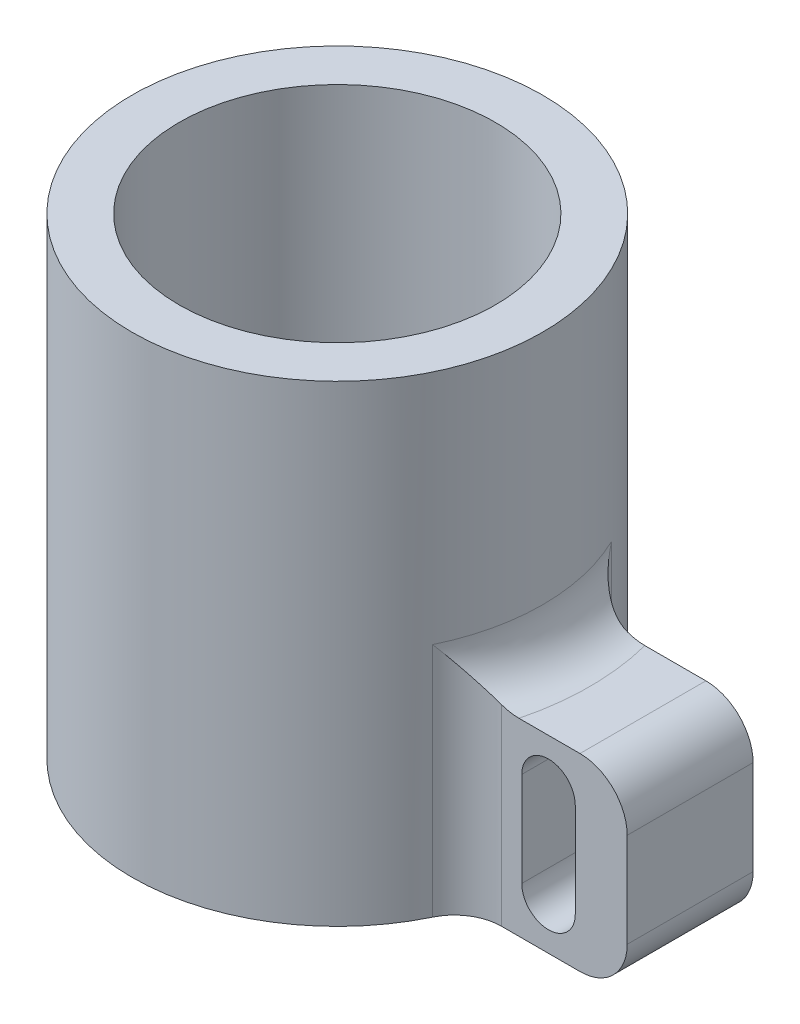
from build123d import *

# Parameters (mm, degrees)
SKETCH_1_R             = 13.05
SKETCH_1_R_2           = 10.05
EXTRUDE_1_DEPTH        = 15
EXTRUDE_2_REACH        = 35.782
EXTRUDE_2_START_RADIUS = 13.05
EXTRUDE_2_END_RADIUS   = 13.05
SKETCH_2_W             = 8
SKETCH_2_H             = 12
CUT_EXTRUDE_1_DEPTH    = 33.025068306
CUT_EXTRUDE_2_DEPTH    = 32.913039886
FILLET_1_R             = 3
FILLET_2_R             = 3
SKETCH_6_R             = 1.75
CUT_EXTRUDE_3_DEPTH    = 30.967350938


with BuildPart() as part:
    # 草图1 → 凸台-拉伸1 (new, symmetric)
    with BuildSketch(Plane(origin=(0, 0, 0), x_dir=(1, 0, 0), z_dir=(0, 1, 0))):
        with Locations(Location((0, 0, 0), (0, 0, 270))):
            Circle(SKETCH_1_R)
        with Locations(Location((0, 0, 0), (0, 0, 270))):
            Circle(SKETCH_1_R_2, mode=Mode.SUBTRACT)
    extrude(amount=EXTRUDE_1_DEPTH, both=True)

    # 凸台-拉伸2: from a cylinder face, 35.782 long prism both ways, kept between that surface and its translate by the depth
    extrude_2_start = Plane(origin=(0, -9, 0), z_dir=(0, -1, 0)) * Cylinder(EXTRUDE_2_START_RADIUS, 98.664, mode=Mode.PRIVATE)
    extrude_2_end = Plane(origin=(10, -9, 0), z_dir=(0, -1, 0)) * Cylinder(EXTRUDE_2_END_RADIUS, 98.664, mode=Mode.PRIVATE)
    # 草图2 → 凸台-拉伸2 (add, from a surface)
    with BuildSketch(Plane(origin=(0, 0, 0), x_dir=(0, 0, -1), z_dir=(1, 0, 0)), mode=Mode.PRIVATE) as extrude_2_sk1:
        with Locations((0, -9)):
            Rectangle(SKETCH_2_W, SKETCH_2_H)
    extrude_2_tool1 = extrude(extrude_2_sk1.sketch, amount=EXTRUDE_2_REACH, both=True, mode=Mode.PRIVATE)
    add(((extrude_2_tool1 - extrude_2_start) & extrude_2_end).solids().sort_by_distance((17.421856, -9, 0))[0])

    # 草图4 → 切除-拉伸1 (cut, through all)
    with BuildSketch(Plane(origin=(0, -3, 0), x_dir=(1, 0, 0), z_dir=(0, 1, 0))):
        with BuildLine():
            Line((22.421855739, 4), (22.421855739, -4))
            ThreePointArc((22.421855739, -4), (23.05, 0), (22.421855739, 4))
        make_face()
    extrude(amount=-CUT_EXTRUDE_1_DEPTH, mode=Mode.SUBTRACT)

    # 草图5 → 切除-拉伸2 (cut, through all)
    with BuildSketch(Plane.XY.offset(4)):
        with BuildLine():
            Line((15.721855739, -12), (15.721855739, -6))
            ThreePointArc((15.721855739, -6), (17.421855739, -4.3), (19.121855739, -6))
            Line((19.121855739, -6), (19.121855739, -12))
            ThreePointArc((19.121855739, -12), (17.421855739, -13.7), (15.721855739, -12))
        make_face()
    extrude(amount=-CUT_EXTRUDE_2_DEPTH, mode=Mode.SUBTRACT)

    # 圆角1
    fillet_1_edges = [part.edges().sort_by_distance(p)[0] for p in [
        (22.421855739, -15, 0),
        (22.421855739, -3, 0),
    ]]
    fillet(fillet_1_edges, radius=FILLET_1_R)

    # 圆角2
    fillet_2_edges = [part.edges().sort_by_distance(p)[0] for p in [
        (12.421855739, -9, -4),
        (13.05, -3, 0),
        (12.421855739, -9, 4),
    ]]
    fillet(fillet_2_edges, radius=FILLET_2_R)

    # 草图6 → 切除-拉伸3 (cut, through all)
    with BuildSketch(Plane(origin=(0, 0, 0), x_dir=(0, 0, -1), z_dir=(1, 0, 0))):
        Circle(SKETCH_6_R)
    extrude(amount=-CUT_EXTRUDE_3_DEPTH, mode=Mode.SUBTRACT)


solid = part.part
